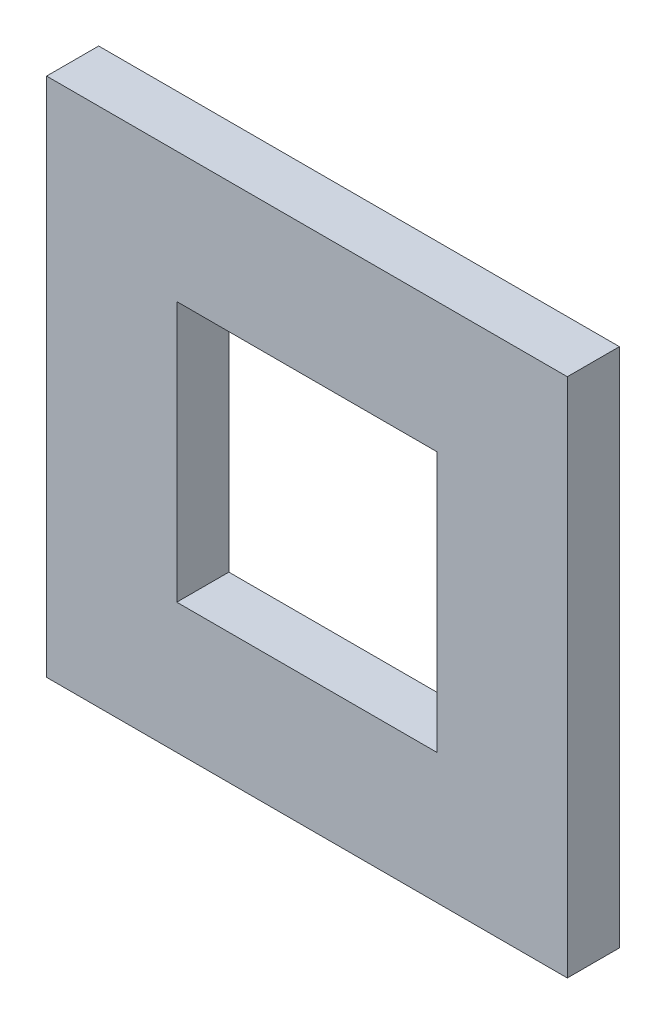
from build123d import *

# Parameters (mm, degrees)
SKETCH1_W           = 25
SKETCH1_H           = 25
BOSS_EXTRUDE1_DEPTH = 2.5
SKETCH2_W           = 12.5
SKETCH2_H           = 12.5
CUT_EXTRUDE1_DEPTH  = 2.5


with BuildPart() as part:
    # Sketch1 → Boss-Extrude1 (new body)
    with BuildSketch(Plane.XY):
        Rectangle(SKETCH1_W, SKETCH1_H)
    extrude(amount=BOSS_EXTRUDE1_DEPTH)

    # Sketch2 → Cut-Extrude1 (cut)
    with BuildSketch(Plane.XY.offset(2.5)):
        Rectangle(SKETCH2_W, SKETCH2_H)
    extrude(amount=-CUT_EXTRUDE1_DEPTH, mode=Mode.SUBTRACT)


solid = part.part
